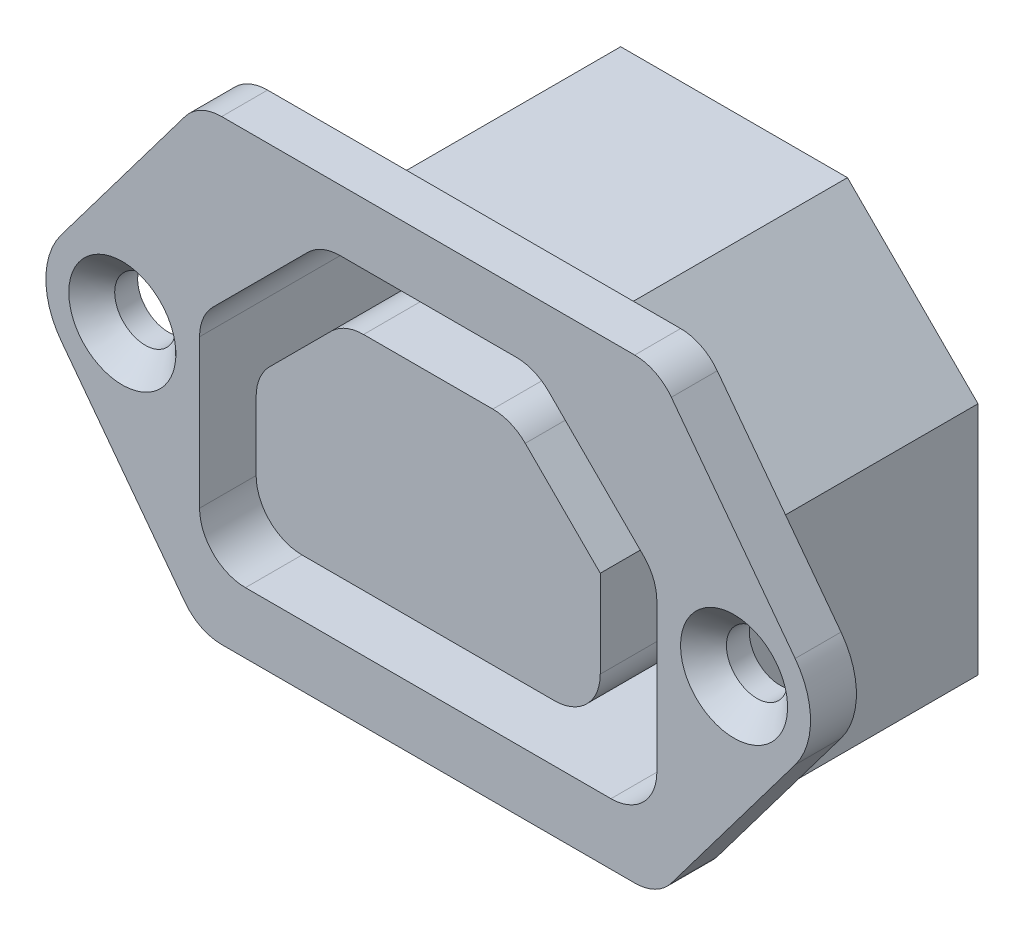
from build123d import *

# Parameters (mm, degrees)
SKETCH1_R           = 2
BOSS_EXTRUDE1_DEPTH = 1.5
BOSS_EXTRUDE2_START = -3
BOSS_EXTRUDE2_DEPTH = 20
BOSS_EXTRUDE3_DEPTH = 1
CHAMFER1_SIZE       = 1.5
FILLET1_R           = 3


with BuildPart() as part:
    # Sketch1 → Boss-Extrude1 (new, symmetric)
    with BuildSketch(Plane.XY):
        with BuildLine():
            Line((-23.993973904, -3.008018028), (-15, -14.95))
            Line((-15, -14.95), (15, -14.95))
            Line((15, -14.95), (23.993973904, -3.008018028))
            ThreePointArc((23.993973904, -3.008018028), (25, 0), (23.993973904, 3.008018028))
            Line((23.993973904, 3.008018028), (15, 14.95))
            Line((15, 14.95), (-15, 14.95))
            Line((-15, 14.95), (-23.993973904, 3.008018028))
            ThreePointArc((-23.993973904, 3.008018028), (-25, 0), (-23.993973904, -3.008018028))
        make_face()
        with Locations((-20, 0)):
            Circle(SKETCH1_R, mode=Mode.SUBTRACT)
        with Locations(Location((20, 0, 0), (0, 0, 180))):
            Circle(SKETCH1_R, mode=Mode.SUBTRACT)
        Polygon((-14.95, 3), (-7, 10.95), (7, 10.95), (14.95, 3), (14.95, -10.95), (-14.95, -10.95), align=None, mode=Mode.SUBTRACT)
    extrude(amount=BOSS_EXTRUDE1_DEPTH, both=True)

    # Sketch2 → Boss-Extrude2 (add)
    # profile 1 of 2: a face of its own
    with BuildSketch(Plane(origin=(0, 0, -1.5), x_dir=(-1, 0, 0), z_dir=(0, 0, -1)).offset(BOSS_EXTRUDE2_START)):
        Polygon((-15.95, 3.414213562), (-7.414213562, 11.95), (7.414213562, 11.95), (15.95, 3.414213562), (15.95, -11.95), (-15.95, -11.95), align=None)
        Polygon((14.95, -10.95), (-14.95, -10.95), (-14.95, 3), (-7, 10.95), (7, 10.95), (14.95, 3), align=None, mode=Mode.SUBTRACT)
    # profile 2 of 2: a face of its own
    with BuildSketch(Plane(origin=(0, 0, -1.5), x_dir=(-1, 0, 0), z_dir=(0, 0, -1)).offset(BOSS_EXTRUDE2_START)):
        Polygon((-11.25, 1.467409819), (-5.467409819, 7.25), (5.467409819, 7.25), (11.25, 1.467409819), (11.25, -7.25), (-11.25, -7.25), align=None)
    extrude(amount=BOSS_EXTRUDE2_DEPTH)


with BuildPart() as boss_extrude2_piece_1:
    # of the separate pieces the step leaves, piece 1, a body of its own (boss_extrude2_pieces)
    add(part.part.solids().sort_by_distance((11.25, 1.467409819, 1.5))[0])



with BuildPart() as boss_extrude2_piece_2:
    # of the separate pieces the step leaves, piece 2, a body of its own (boss_extrude2_pieces)
    add(part.part.solids().sort_by_distance((-23.993973904, 3.008018028, -1.5))[0])


with BuildPart() as boss_extrude2_piece_1_1:
    add(boss_extrude2_piece_1.part)

    add(boss_extrude2_piece_2.part)  # Boss-Extrude3 merges Boss-Extrude2 piece 2
    # Sketch3 → Boss-Extrude3 (add)
    with BuildSketch(Plane(origin=(0, 0, -18.5), x_dir=(-1, 0, 0), z_dir=(0, 0, -1))):
        Polygon((15.95, -11.95), (15.95, 3.414213562), (7.414213562, 11.95), (-7.414213562, 11.95), (-15.95, 3.414213562), (-15.95, -11.95), align=None)
    extrude(amount=-BOSS_EXTRUDE3_DEPTH)

    # Chamfer1
    chamfer1_edges = [boss_extrude2_piece_1_1.edges().sort_by_distance(p)[0] for p in [
        (-22, 0, 1.5),
        (22, 0, 1.5),
    ]]
    chamfer(chamfer1_edges, length=CHAMFER1_SIZE)

    # Fillet1
    fillet1_edges = [boss_extrude2_piece_1_1.edges().sort_by_distance(p)[0] for p in [
        (-5.467409819, 7.25, -8),
        (5.467409819, 7.25, -8),
        (11.25, -7.25, -8),
        (-11.25, -7.25, -8),
        (-11.25, 1.467409819, -8),
        (-15, 14.95, 0),
        (15, 14.95, 0),
        (15, -14.95, 0),
        (-15, -14.95, 0),
        (14.95, -10.95, -8),
        (14.95, 3, -8),
        (7, 10.95, -8),
        (-7, 10.95, -8),
        (-14.95, 3, -8),
        (-14.95, -10.95, -8),
    ]]
    fillet(fillet1_edges, radius=FILLET1_R)


solid = boss_extrude2_piece_1_1.part
